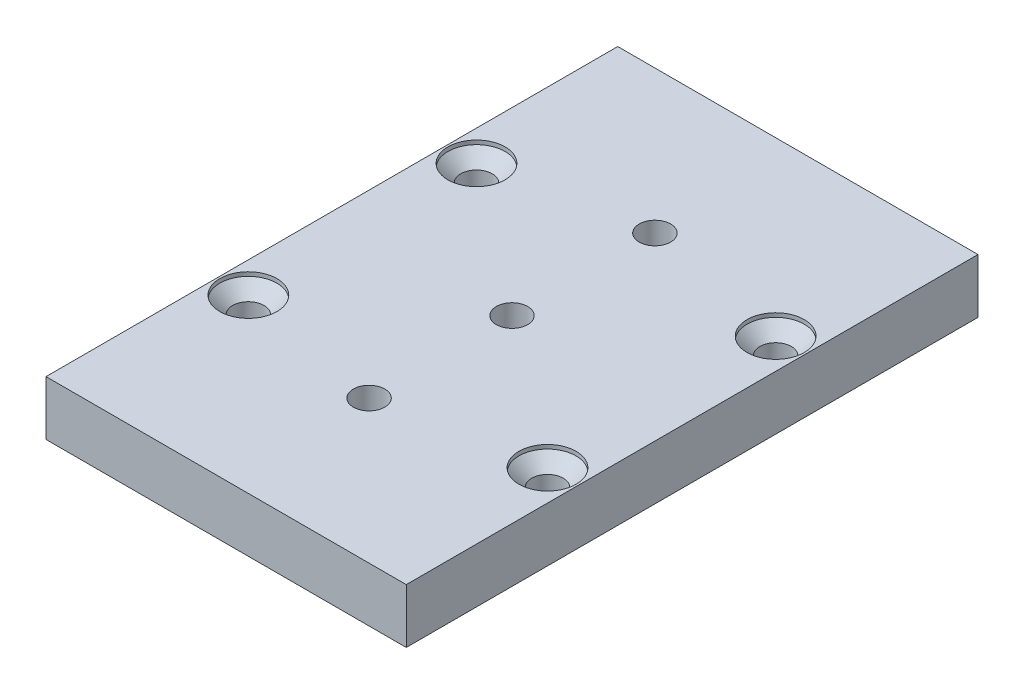
from build123d import *

# Parameters (mm, degrees)
ESBO_O1_W                       = 63.01
ESBO_O1_H                       = 100
RESSALTO_EXTRUS_O1_DEPTH        = 9.525
ESBO_O2_R                       = 2.75
CORTE_EXTRUS_O1_DEPTH           = 10
ESBO_O3_R                       = 5
CORTE_EXTRUS_O2_DEPTH           = 0.7
ESBO_O4_R                       = 5
CORTE_EXTRUS_O3_DEPTH           = 2.5
CORTE_EXTRUS_O3_DRAFT           = -45
CORTE_EXTRUS_O3_PROFILE_2_DEPTH = 2.5
CORTE_EXTRUS_O3_PROFILE_2_DRAFT = -45
CORTE_EXTRUS_O3_PROFILE_3_DEPTH = 2.5
CORTE_EXTRUS_O3_PROFILE_3_DRAFT = -45
CORTE_EXTRUS_O3_PROFILE_4_DEPTH = 2.5
CORTE_EXTRUS_O3_PROFILE_4_DRAFT = -45


with BuildPart() as part:
    # Esboço1 → Ressalto-extrusão1 (new body)
    with BuildSketch(Plane(origin=(0, 0, 0), x_dir=(1, 0, 0), z_dir=(0, 1, 0))):
        Rectangle(ESBO_O1_W, ESBO_O1_H)
    extrude(amount=RESSALTO_EXTRUS_O1_DEPTH)

    # Esboço2 → Corte-extrusão1 (cut)
    with BuildSketch(Plane.XZ):
        with Locations(Location((-26.16, 19.950903247, 0), (0, 0, 270))):
            Circle(ESBO_O2_R)
        with Locations(Location((0, 25, 0), (0, 0, 270))):
            Circle(ESBO_O2_R)
        with Locations(Location((26.16, 19.950903247, 0), (0, 0, 270))):
            Circle(ESBO_O2_R)
        with Locations(Location((0, 0, 0), (0, 0, 270))):
            Circle(ESBO_O2_R)
        with Locations(Location((-26.16, -19.95, 0), (0, 0, 270))):
            Circle(ESBO_O2_R)
        with Locations(Location((0, -25, 0), (0, 0, 270))):
            Circle(ESBO_O2_R)
        with Locations(Location((26.16, -19.95, 0), (0, 0, 270))):
            Circle(ESBO_O2_R)
    extrude(amount=-CORTE_EXTRUS_O1_DEPTH, mode=Mode.SUBTRACT)

    # Esboço3 → Corte-extrusão2 (cut)
    with BuildSketch(Plane(origin=(0, 9.525, 0), x_dir=(1, 0, 0), z_dir=(0, 1, 0))):
        with Locations(Location((26.16, 19.95, 0), (0, 0, 270))):
            Circle(ESBO_O3_R)
        with Locations(Location((26.16, -19.950903247, 0), (0, 0, 270))):
            Circle(ESBO_O3_R)
        with Locations(Location((-26.16, -19.950903247, 0), (0, 0, 270))):
            Circle(ESBO_O3_R)
        with Locations(Location((-26.16, 19.95, 0), (0, 0, 270))):
            Circle(ESBO_O3_R)
    extrude(amount=-CORTE_EXTRUS_O2_DEPTH, mode=Mode.SUBTRACT)


with BuildPart() as corte_extrus_o3_tool:
    # Esboço4 → Corte-extrusão3 (with draft: the straight prism first)
    with BuildSketch(Plane(origin=(0, 8.825, 0), x_dir=(1, 0, 0), z_dir=(0, 1, 0))):
        with Locations(Location((26.16, 19.95, 0), (0, 0, 270))):
            Circle(ESBO_O4_R)
    extrude(amount=-CORTE_EXTRUS_O3_DEPTH)
    # Corte-extrusão3: the draft: its side faces are tilted about the plane it starts from
    corte_extrus_o3_sides = [corte_extrus_o3_tool.faces().sort_by_distance(p)[0] for p in [
        (26.16, 7.575, -24.95),
    ]]
    draft(corte_extrus_o3_sides, Plane(origin=(0, 8.825, 0), x_dir=(1, 0, 0), z_dir=(0, 1, 0)), CORTE_EXTRUS_O3_DRAFT)


with BuildPart() as part_1:
    add(part.part)

    # Corte-extrusão3: cut by corte_extrus_o3_tool
    add(corte_extrus_o3_tool.part, mode=Mode.SUBTRACT)


with BuildPart() as corte_extrus_o3_profile_2_tool:
    # Esboço4 → Corte-extrusão3 profile 2 (with draft: the straight prism first)
    with BuildSketch(Plane(origin=(0, 8.825, 0), x_dir=(1, 0, 0), z_dir=(0, 1, 0))):
        with Locations(Location((-26.16, 19.95, 0), (0, 0, 270))):
            Circle(ESBO_O4_R)
    extrude(amount=-CORTE_EXTRUS_O3_PROFILE_2_DEPTH)
    # Corte-extrusão3 profile 2: the draft: its side faces are tilted about the plane it starts from
    corte_extrus_o3_profile_2_sides = [corte_extrus_o3_profile_2_tool.faces().sort_by_distance(p)[0] for p in [
        (-26.16, 7.575, -24.95),
    ]]
    draft(corte_extrus_o3_profile_2_sides, Plane(origin=(0, 8.825, 0), x_dir=(1, 0, 0), z_dir=(0, 1, 0)), CORTE_EXTRUS_O3_PROFILE_2_DRAFT)


with BuildPart() as part_2:
    add(part_1.part)

    # Corte-extrusão3 profile 2: cut by corte_extrus_o3_profile_2_tool
    add(corte_extrus_o3_profile_2_tool.part, mode=Mode.SUBTRACT)


with BuildPart() as corte_extrus_o3_profile_3_tool:
    # Esboço4 → Corte-extrusão3 profile 3 (with draft: the straight prism first)
    with BuildSketch(Plane(origin=(0, 8.825, 0), x_dir=(1, 0, 0), z_dir=(0, 1, 0))):
        with Locations(Location((-26.16, -19.950903247, 0), (0, 0, 270))):
            Circle(ESBO_O4_R)
    extrude(amount=-CORTE_EXTRUS_O3_PROFILE_3_DEPTH)
    # Corte-extrusão3 profile 3: the draft: its side faces are tilted about the plane it starts from
    corte_extrus_o3_profile_3_sides = [corte_extrus_o3_profile_3_tool.faces().sort_by_distance(p)[0] for p in [
        (-26.16, 7.575, 14.950903247),
    ]]
    draft(corte_extrus_o3_profile_3_sides, Plane(origin=(0, 8.825, 0), x_dir=(1, 0, 0), z_dir=(0, 1, 0)), CORTE_EXTRUS_O3_PROFILE_3_DRAFT)


with BuildPart() as part_3:
    add(part_2.part)

    # Corte-extrusão3 profile 3: cut by corte_extrus_o3_profile_3_tool
    add(corte_extrus_o3_profile_3_tool.part, mode=Mode.SUBTRACT)


with BuildPart() as corte_extrus_o3_profile_4_tool:
    # Esboço4 → Corte-extrusão3 profile 4 (with draft: the straight prism first)
    with BuildSketch(Plane(origin=(0, 8.825, 0), x_dir=(1, 0, 0), z_dir=(0, 1, 0))):
        with Locations(Location((26.16, -19.950903247, 0), (0, 0, 270))):
            Circle(ESBO_O4_R)
    extrude(amount=-CORTE_EXTRUS_O3_PROFILE_4_DEPTH)
    # Corte-extrusão3 profile 4: the draft: its side faces are tilted about the plane it starts from
    corte_extrus_o3_profile_4_sides = [corte_extrus_o3_profile_4_tool.faces().sort_by_distance(p)[0] for p in [
        (26.16, 7.575, 14.950903247),
    ]]
    draft(corte_extrus_o3_profile_4_sides, Plane(origin=(0, 8.825, 0), x_dir=(1, 0, 0), z_dir=(0, 1, 0)), CORTE_EXTRUS_O3_PROFILE_4_DRAFT)


with BuildPart() as part_4:
    add(part_3.part)

    # Corte-extrusão3 profile 4: cut by corte_extrus_o3_profile_4_tool
    add(corte_extrus_o3_profile_4_tool.part, mode=Mode.SUBTRACT)


solid = part_4.part
